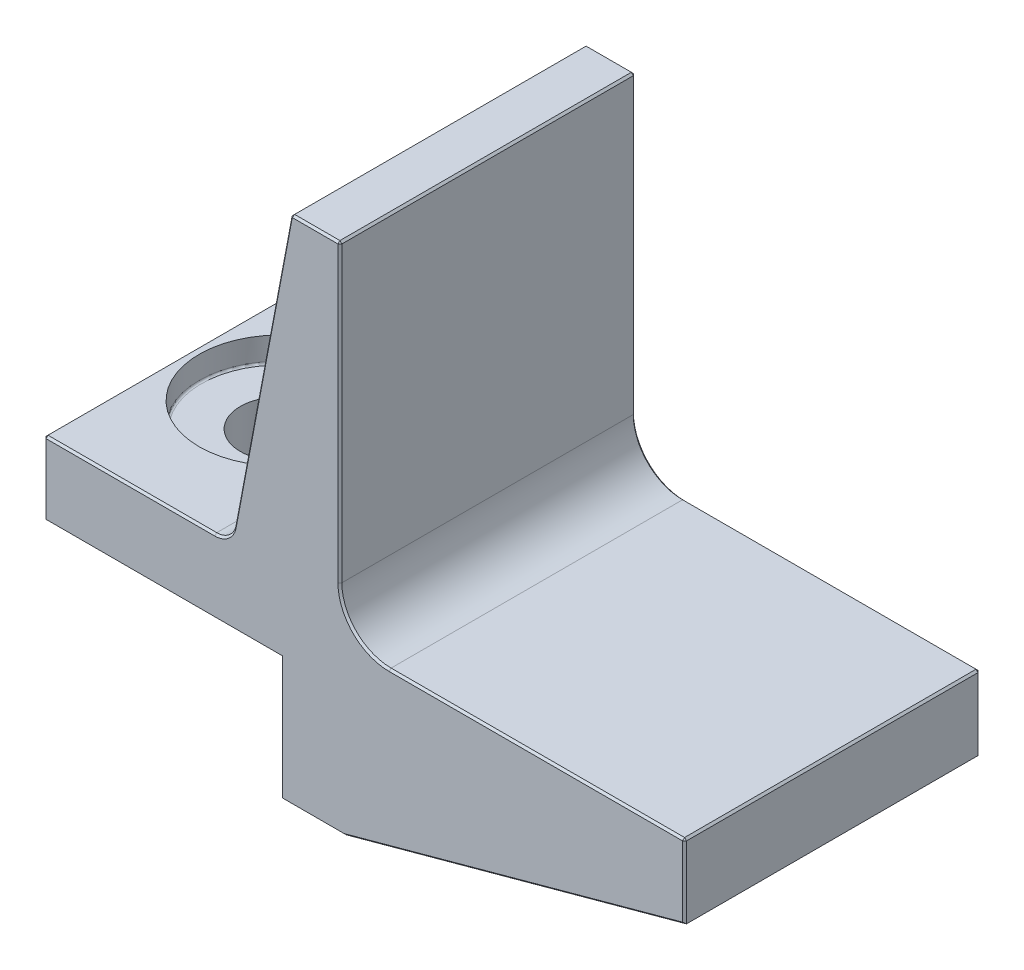
from build123d import *
from OCP.BRepFilletAPI import BRepFilletAPI_MakeChamfer

# Parameters (mm, degrees)
BOSS_EXTRUDE1_DEPTH                                  = 38.1
CBORE_FOR_3_8_BINDING_HEAD_MACHINE_SCREW_D           = 10.0838
CBORE_FOR_3_8_BINDING_HEAD_MACHINE_SCREW_CBORE_D     = 20.6756
CBORE_FOR_3_8_BINDING_HEAD_MACHINE_SCREW_CBORE_DEPTH = 3.175
FILLET1_R                                            = 2.54
FILLET2_R                                            = 6.35
CHAMFER1_SIZE                                        = 0.254
CHAMFER1_SIZE2                                       = 0.31888992
FILLET3_R                                            = 0.254
CHAMFER2_SIZE                                        = 0.254


with BuildPart() as part:
    # Sketch1 → Boss-Extrude1 (new body)
    with BuildSketch(Plane.XY):
        Polygon((0, 0), (44.45, 0), (44.45, -9.525), (0.5741924, -21.517102), (-7.6808076, -21.517102), (-7.6808076, -5.642102), (-38.1608076, -5.642102), (-38.1608076, 3.882898), (-14.0308076, 3.882898), (-6.35, 44.45), (0, 44.45), align=None)
    extrude(amount=BOSS_EXTRUDE1_DEPTH)

    # CBORE for 3/8 Binding Head Machine Screw1 (through all)
    with Locations(Plane(origin=(0, 3.882898, 0), x_dir=(1, 0, 0), z_dir=(0, 1, 0))):
        with Locations((-26.8578076, -19.05)):
            CounterBoreHole(CBORE_FOR_3_8_BINDING_HEAD_MACHINE_SCREW_D / 2, CBORE_FOR_3_8_BINDING_HEAD_MACHINE_SCREW_CBORE_D / 2, CBORE_FOR_3_8_BINDING_HEAD_MACHINE_SCREW_CBORE_DEPTH)

    # Fillet1
    fillet1_edges = [part.edges().sort_by_distance(p)[0] for p in [
        (-14.0308076, 3.882898, 19.05),
    ]]
    fillet(fillet1_edges, radius=FILLET1_R)

    # Fillet2
    fillet2_edges = [part.edges().sort_by_distance(p)[0] for p in [
        (0, 0, 19.05),
    ]]
    fillet(fillet2_edges, radius=FILLET2_R)

    # Chamfer1: one chamfer whose edges measure the first distance from different faces: ONE call of the kernel's chamfer builder (chamfer() names one face for all edges)
    chamfer1_edges_1 = [part.edges().sort_by_distance(p)[0] for p in [
        (25.4, 0, 0),
        (44.45, -4.7625, 0),
        (22.5120962, -15.521051, 0),
        (-3.5533076, -21.517102, 0),
        (-7.6808076, -13.579602, 0),
        (-9.994679571, 25.200189874, 38.1),
        (-22.9208076, -5.642102, 0),
        (-38.1608076, -0.879602, 0),
        (-9.994679571, 25.200189874, 0),
        (-3.175, 44.45, 0),
        (44.45, 0, 19.05),
        (-38.1608076, -5.642102, 19.05),
        (-38.1608076, 3.882898, 19.05),
        (0, 44.45, 19.05),
        (-38.1608076, -0.879602, 38.1),
        (-22.9208076, -5.642102, 38.1),
        (-7.6808076, -13.579602, 38.1),
        (-3.5533076, -21.517102, 38.1),
        (22.5120962, -15.521051, 38.1),
        (44.45, -4.7625, 38.1),
        (-27.147914139, 3.882898, 0),
        (-27.147914139, 3.882898, 38.1),
        (-14.514618931, 4.466907668, 0),
        (-14.514618931, 4.466907668, 38.1),
        (25.4, 0, 38.1),
        (0, 25.4, 0),
        (0, 25.4, 38.1),
        (1.859871939, 1.859871939, 0),
        (1.859871939, 1.859871939, 38.1),
        (-3.175, 44.45, 38.1),
    ]]
    chamfer1_edges_2 = [part.edges().sort_by_distance(p)[0] for p in [
        (-6.35, 44.45, 19.05),
    ]]
    chamfer1_side_2 = [part.faces().sort_by_distance(p)[0] for p in [
        (-3.175, 44.45, 19.05),
    ]]
    chamfer1 = BRepFilletAPI_MakeChamfer(part.part.solid().wrapped)
    for e in chamfer1_edges_1:
        chamfer1.Add(CHAMFER1_SIZE, e.wrapped)
    for e in chamfer1_edges_2:
        chamfer1.Add(CHAMFER1_SIZE, CHAMFER1_SIZE2, e.wrapped, chamfer1_side_2[0].wrapped)  # the first distance lies on this face
    add(Compound.cast(chamfer1.Shape()), mode=Mode.REPLACE)

    # Fillet3
    fillet3_edges = [part.edges().sort_by_distance(p)[0] for p in [
        (-37.1956076, 0.707898, 19.05),
    ]]
    fillet(fillet3_edges, radius=FILLET3_R)

    # Chamfer2
    chamfer2_edges = [part.edges().sort_by_distance(p)[0] for p in [
        (-21.8159076, -5.642102, 19.05),
    ]]
    chamfer(chamfer2_edges, length=CHAMFER2_SIZE)


solid = part.part
